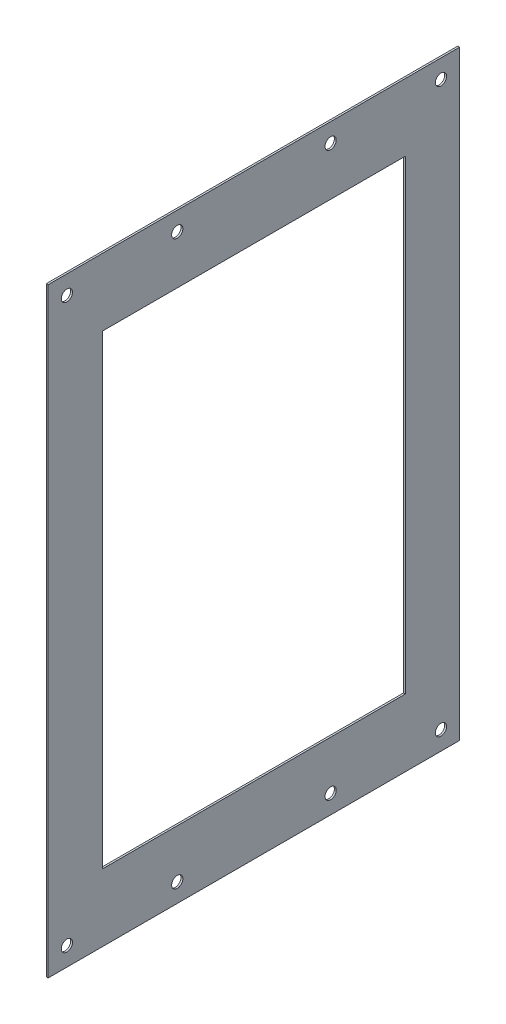
from build123d import *

# Parameters (mm, degrees)
SKETCH1_W           = 321
SKETCH1_H           = 220
BOSS_EXTRUDE1_DEPTH = 1
SKETCH2_R           = 3
CUT_EXTRUDE1_DEPTH  = 195.579675198
SKETCH3_W           = 249
SKETCH3_H           = 162
CUT_EXTRUDE2_DEPTH  = 195.579675198
SKETCH4_R           = 3
CUT_EXTRUDE3_DEPTH  = 195.579675198


with BuildPart() as part:
    # Sketch1 → Boss-Extrude1 (new body)
    with BuildSketch(Plane.YZ):
        Rectangle(SKETCH1_W, SKETCH1_H)
    extrude(amount=BOSS_EXTRUDE1_DEPTH)

    # Sketch2 → Cut-Extrude1 (cut, through all)
    with BuildSketch(Plane.YZ.offset(1)):
        with Locations(Location((-150.5, 100, 0), (0, 0, 270))):
            Circle(SKETCH2_R)
        with Locations(Location((150.5, 100, 0), (0, 0, 90))):
            Circle(SKETCH2_R)
        with Locations(Location((-150.5, -100, 0), (0, 0, 90))):
            Circle(SKETCH2_R)
        with Locations(Location((150.5, -100, 0), (0, 0, 270))):
            Circle(SKETCH2_R)
    extrude(amount=-CUT_EXTRUDE1_DEPTH, mode=Mode.SUBTRACT)

    # Sketch3 → Cut-Extrude2 (cut, through all)
    with BuildSketch(Plane.YZ.offset(1)):
        Rectangle(SKETCH3_W, SKETCH3_H)
    extrude(amount=-CUT_EXTRUDE2_DEPTH, mode=Mode.SUBTRACT)

    # Sketch4 → Cut-Extrude3 (cut, through all)
    with BuildSketch(Plane.YZ.offset(1)):
        with Locations(Location((-150.5, 41, 0), (0, 0, 270))):
            Circle(SKETCH4_R)
        with Locations(Location((150.5, 41, 0), (0, 0, 90))):
            Circle(SKETCH4_R)
        with Locations(Location((-150.5, -41, 0), (0, 0, 90))):
            Circle(SKETCH4_R)
        with Locations(Location((150.5, -41, 0), (0, 0, 270))):
            Circle(SKETCH4_R)
    extrude(amount=-CUT_EXTRUDE3_DEPTH, mode=Mode.SUBTRACT)


solid = part.part
